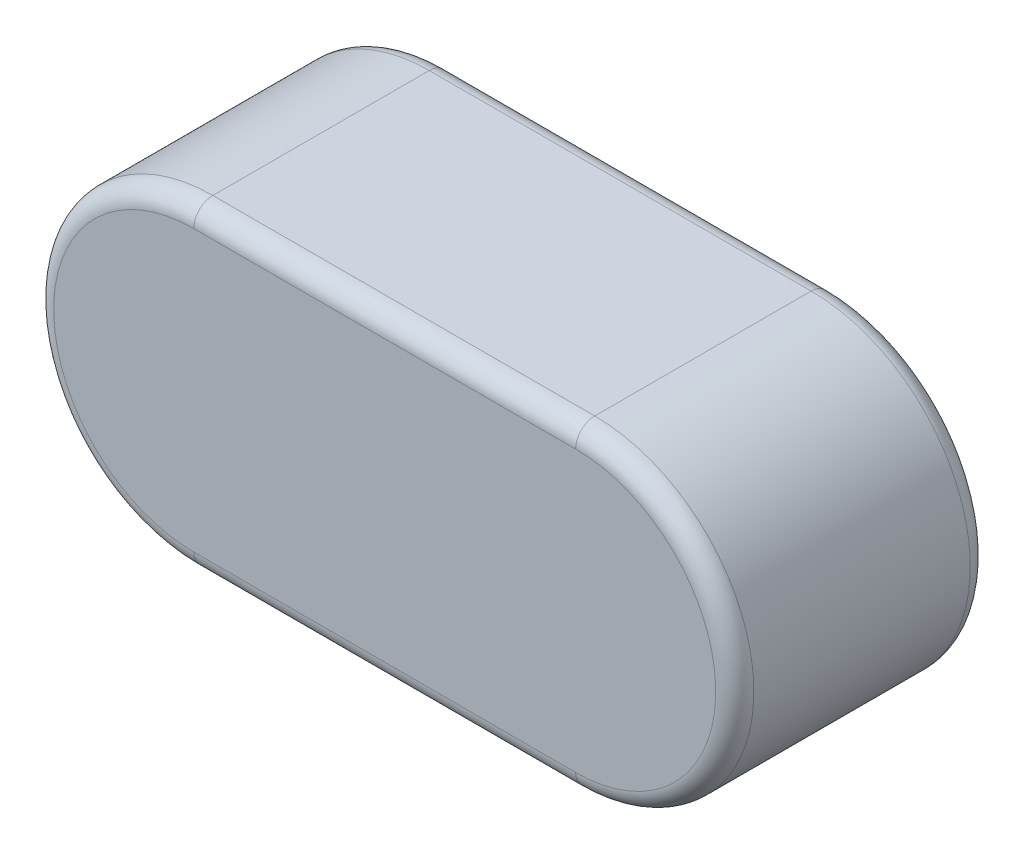
from build123d import *

# Parameters (mm, degrees)
EXTRUDE_527_DEPTH = 8
FILLET_1_R        = 0.6


with BuildPart() as part:
    # 草图1 → Extrude 527 (new body)
    with BuildSketch(Plane.XY):
        with BuildLine():
            Line((-6, 5), (6, 5))
            ThreePointArc((6, 5), (11, 0), (6, -5))
            Line((6, -5), (-6, -5))
            ThreePointArc((-6, -5), (-11, 0), (-6, 5))
        make_face()
    extrude(amount=EXTRUDE_527_DEPTH)

    # 圆角1
    fillet_1_edges = [part.edges().sort_by_distance(p)[0] for p in [
        (11, 0, 8),
        (0, 5, 8),
        (-11, 0, 8),
        (0, 5, 0),
        (11, 0, 0),
        (0, -5, 0),
        (-11, 0, 0),
        (0, -5, 8),
    ]]
    fillet(fillet_1_edges, radius=FILLET_1_R)


solid = part.part
